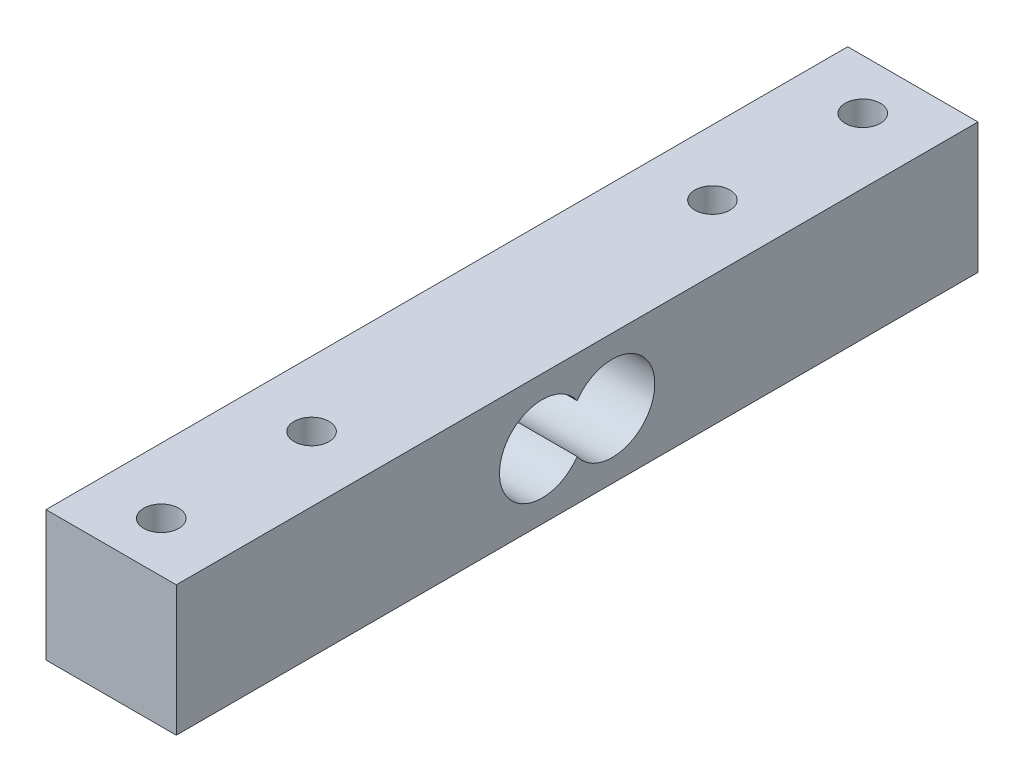
from build123d import *

# Parameters (mm, degrees)
SKETCH_1_W               = 13
SKETCH_1_H               = 80
EXTRUDE_1_DEPTH          = 6.5
CUT_EXTRUDE_1_DEPTH      = 42.042660732
CUT_EXTRUDE_1_DEPTH_BACK = 42.042660732
SKETCH_4_R               = 1.75
CUT_EXTRUDE_2_DEPTH      = 42.042660732


with BuildPart() as part:
    # 스케치1 → 보스-돌출1 (new, symmetric)
    with BuildSketch(Plane(origin=(0, 0, 0), x_dir=(1, 0, 0), z_dir=(0, 1, 0))):
        Rectangle(SKETCH_1_W, SKETCH_1_H)
    extrude(amount=EXTRUDE_1_DEPTH, both=True)

    # 스케치3 → 컷-돌출1 (cut, two sides: drawn at the far end of the back side and taken through both)
    with BuildSketch(Plane(origin=(0, 0, 0), x_dir=(0, 0, -1), z_dir=(1, 0, 0)).offset(-CUT_EXTRUDE_1_DEPTH_BACK)):
        with BuildLine():
            ThreePointArc((0, 2.41091269), (0.55817077, 1.262438117), (0.75, 0))
            Line((0.75, 0), (7.75, 0))
            ThreePointArc((7.75, 0), (4.762438117, 4.05817077), (0, 2.41091269))
        make_face()
        with BuildLine():
            ThreePointArc((0, -2.41091269), (0.55817077, -1.262438117), (0.75, 0))
            Line((0.75, 0), (-0.75, 0))
            ThreePointArc((-0.75, 0), (-0.55817077, -1.262438117), (0, -2.41091269))
        make_face()
        with BuildLine():
            Line((-0.75, 0), (0.75, 0))
            ThreePointArc((0.75, 0), (0.55817077, 1.262438117), (0, 2.41091269))
            ThreePointArc((0, 2.41091269), (-0.55817077, 1.262438117), (-0.75, 0))
        make_face()
        with BuildLine():
            Line((7.75, 0), (0.75, 0))
            ThreePointArc((0.75, 0), (0.55817077, -1.262438117), (0, -2.41091269))
            ThreePointArc((0, -2.41091269), (4.762438117, -4.05817077), (7.75, 0))
        make_face()
        with BuildLine():
            ThreePointArc((0, -2.41091269), (-0.55817077, -1.262438117), (-0.75, 0))
            Line((-0.75, 0), (-7.75, 0))
            ThreePointArc((-7.75, 0), (-4.762438117, -4.05817077), (0, -2.41091269))
        make_face()
        with BuildLine():
            Line((-7.75, 0), (-0.75, 0))
            ThreePointArc((-0.75, 0), (-0.55817077, 1.262438117), (0, 2.41091269))
            ThreePointArc((0, 2.41091269), (-4.762438117, 4.05817077), (-7.75, 0))
        make_face()
    extrude(amount=CUT_EXTRUDE_1_DEPTH + CUT_EXTRUDE_1_DEPTH_BACK, mode=Mode.SUBTRACT)

    # 스케치4 → 컷-돌출2 (cut, symmetric)
    with BuildSketch(Plane(origin=(0, 0, 0), x_dir=(1, 0, 0), z_dir=(0, 1, 0))):
        with Locations(Location((0, 35, 0), (0, 0, 270))):
            Circle(SKETCH_4_R)
        with Locations(Location((0, 20, 0), (0, 0, 270))):
            Circle(SKETCH_4_R)
    cut_extrude_2 = extrude(amount=CUT_EXTRUDE_2_DEPTH, both=True, mode=Mode.SUBTRACT)

    # 대칭 복사1: 컷-돌출2 across plane
    add(cut_extrude_2.mirror(Plane.XY), mode=Mode.SUBTRACT)


solid = part.part
